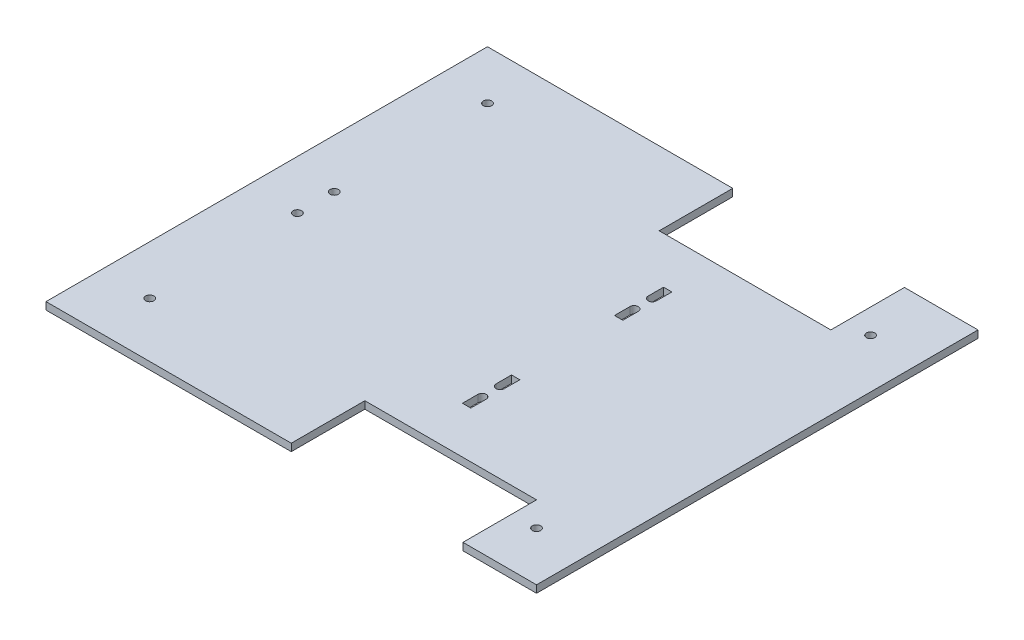
from build123d import *

# Parameters (mm, degrees)
SKETCH1_R           = 43.18
BOSS_EXTRUDE1_DEPTH = 76.2


with BuildPart() as part:
    # Sketch1 → Boss-Extrude1 (new body)
    with BuildSketch(Plane(origin=(0, 0, 0), x_dir=(1, 0, 0), z_dir=(0, 1, 0))):
        Polygon((-48.943073508, 29.635887653), (1729.056926492, 29.635887653), (1729.056926492, -732.364112347), (2491.056926492, -732.364112347), (2491.056926492, 3839.635887653), (1729.056926492, 3839.635887653), (1729.056926492, 3077.635887653), (-48.943073508, 3077.635887653), (-48.943073508, 3839.635887653), (-2588.943073508, 3839.635887653), (-2588.943073508, -732.364112347), (-48.943073508, -732.364112347), align=None)
        with Locations(Location((-2080.943073508, -166.508163088, 0), (0, 0, 90))):
            Circle(SKETCH1_R, mode=Mode.SUBTRACT)
        with Locations(Location((-2080.943073508, 1744.135887653, 0), (0, 0, 90))):
            Circle(SKETCH1_R, mode=Mode.SUBTRACT)
        with Locations(Location((-2080.943073508, 1363.135887653, 0), (0, 0, 90))):
            Circle(SKETCH1_R, mode=Mode.SUBTRACT)
        with Locations(Location((-2080.943073508, 3331.635887653, 0), (0, 0, 90))):
            Circle(SKETCH1_R, mode=Mode.SUBTRACT)
        with Locations(Location((1983.056926492, -224.364112347, 0), (0, 0, 90))):
            Circle(SKETCH1_R, mode=Mode.SUBTRACT)
        with Locations(Location((1983.056926492, 3235.099053778, 0), (0, 0, 90))):
            Circle(SKETCH1_R, mode=Mode.SUBTRACT)
        with BuildLine():
            Line((565.736926492, 2435.015887653), (565.736926492, 2595.035887653))
            Line((565.736926492, 2595.035887653), (479.376926492, 2595.035887653))
            Line((479.376926492, 2595.035887653), (479.376926492, 2435.015887653))
            ThreePointArc((479.376926492, 2435.015887653), (522.556926492, 2391.835887653), (565.736926492, 2435.015887653))
        make_face(mode=Mode.SUBTRACT)
        with BuildLine():
            Line((565.736926492, 2247.055887653), (565.736926492, 2087.035887653))
            Line((565.736926492, 2087.035887653), (479.376926492, 2087.035887653))
            Line((479.376926492, 2087.035887653), (479.376926492, 2247.055887653))
            ThreePointArc((479.376926492, 2247.055887653), (522.556926492, 2290.235887653), (565.736926492, 2247.055887653))
        make_face(mode=Mode.SUBTRACT)
        with BuildLine():
            Line((479.376926492, 1020.235887653), (479.376926492, 860.215887653))
            ThreePointArc((479.376926492, 860.215887653), (522.556926492, 817.035887653), (565.736926492, 860.215887653))
            Line((565.736926492, 860.215887653), (565.736926492, 1020.235887653))
            Line((565.736926492, 1020.235887653), (479.376926492, 1020.235887653))
        make_face(mode=Mode.SUBTRACT)
        with BuildLine():
            Line((479.376926492, 512.235887653), (479.376926492, 672.255887653))
            ThreePointArc((479.376926492, 672.255887653), (522.556926492, 715.435887653), (565.736926492, 672.255887653))
            Line((565.736926492, 672.255887653), (565.736926492, 512.235887653))
            Line((565.736926492, 512.235887653), (479.376926492, 512.235887653))
        make_face(mode=Mode.SUBTRACT)
    extrude(amount=BOSS_EXTRUDE1_DEPTH)


solid = part.part
